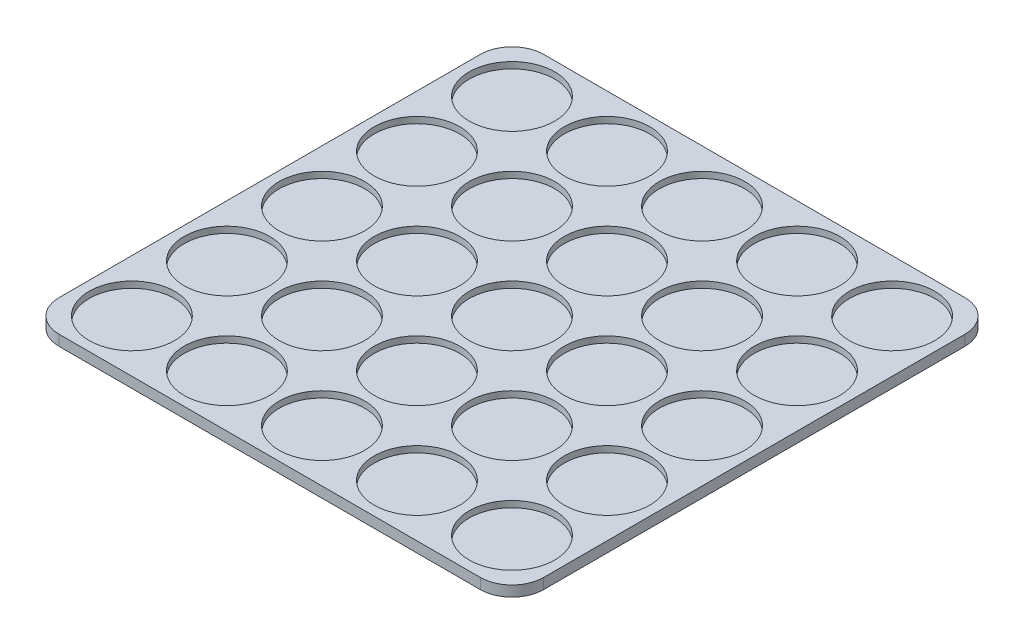
from build123d import *

# Parameters (mm, degrees)
SKETCH1_W           = 229.5
SKETCH1_H           = 229.5
BOSS_EXTRUDE1_DEPTH = 5
SKETCH2_R           = 20.25
CUT_EXTRUDE1_DEPTH  = 3
FILLET1_R           = 15


with BuildPart() as part:
    # Sketch1 → Boss-Extrude1 (new body)
    with BuildSketch(Plane(origin=(0, 0, 0), x_dir=(1, 0, 0), z_dir=(0, 1, 0))):
        Rectangle(SKETCH1_W, SKETCH1_H)
    extrude(amount=BOSS_EXTRUDE1_DEPTH)

    # Sketch2 → Cut-Extrude1 (cut)
    with BuildSketch(Plane(origin=(0, 5, 0), x_dir=(1, 0, 0), z_dir=(0, 1, 0))):
        with Locations(Location((-90, 90, 0), (0, 0, 270))):
            Circle(SKETCH2_R)
        with Locations(Location((-45, 90, 0), (0, 0, 270))):
            Circle(SKETCH2_R)
        with Locations(Location((0, 90, 0), (0, 0, 270))):
            Circle(SKETCH2_R)
        with Locations(Location((45, 90, 0), (0, 0, 270))):
            Circle(SKETCH2_R)
        with Locations(Location((90, 90, 0), (0, 0, 270))):
            Circle(SKETCH2_R)
        with Locations(Location((-45, 45, 0), (0, 0, 270))):
            Circle(SKETCH2_R)
        with Locations(Location((0, 45, 0), (0, 0, 270))):
            Circle(SKETCH2_R)
        with Locations(Location((45, 45, 0), (0, 0, 270))):
            Circle(SKETCH2_R)
        with Locations(Location((90, 45, 0), (0, 0, 270))):
            Circle(SKETCH2_R)
        with Locations(Location((-45, 0, 0), (0, 0, 270))):
            Circle(SKETCH2_R)
        with Locations(Location((0, 0, 0), (0, 0, 270))):
            Circle(SKETCH2_R)
        with Locations(Location((45, 0, 0), (0, 0, 270))):
            Circle(SKETCH2_R)
        with Locations(Location((90, 0, 0), (0, 0, 270))):
            Circle(SKETCH2_R)
        with Locations(Location((-45, -45, 0), (0, 0, 270))):
            Circle(SKETCH2_R)
        with Locations(Location((0, -45, 0), (0, 0, 270))):
            Circle(SKETCH2_R)
        with Locations(Location((45, -45, 0), (0, 0, 270))):
            Circle(SKETCH2_R)
        with Locations(Location((90, -45, 0), (0, 0, 270))):
            Circle(SKETCH2_R)
        with Locations(Location((-45, -90, 0), (0, 0, 270))):
            Circle(SKETCH2_R)
        with Locations(Location((0, -90, 0), (0, 0, 270))):
            Circle(SKETCH2_R)
        with Locations(Location((45, -90, 0), (0, 0, 270))):
            Circle(SKETCH2_R)
        with Locations(Location((90, -90, 0), (0, 0, 270))):
            Circle(SKETCH2_R)
        with Locations(Location((-90, 45, 0), (0, 0, 270))):
            Circle(SKETCH2_R)
        with Locations(Location((-90, 0, 0), (0, 0, 270))):
            Circle(SKETCH2_R)
        with Locations(Location((-90, -45, 0), (0, 0, 270))):
            Circle(SKETCH2_R)
        with Locations(Location((-90, -90, 0), (0, 0, 270))):
            Circle(SKETCH2_R)
    extrude(amount=-CUT_EXTRUDE1_DEPTH, mode=Mode.SUBTRACT)

    # Fillet1
    fillet1_edges = [part.edges().sort_by_distance(p)[0] for p in [
        (114.75, 2.5, 114.75),
        (-114.75, 2.5, 114.75),
        (-114.75, 2.5, -114.75),
        (114.75, 2.5, -114.75),
    ]]
    fillet(fillet1_edges, radius=FILLET1_R)


solid = part.part
